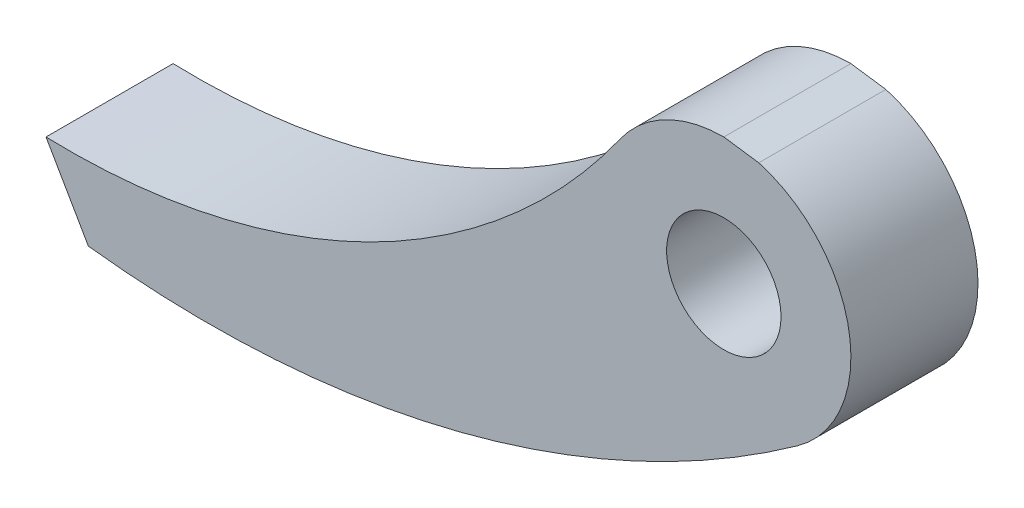
from build123d import *

# Parameters (mm, degrees)
SKETCH1_R  = 1.35
PAWL_DEPTH = 1.5


with BuildPart() as part:
    # Sketch1 → Pawl (new, symmetric)
    with BuildSketch(Plane.XY):
        with BuildLine():
            Line((0.824491602, 2.884478046), (0, 3))
            ThreePointArc((0, 3), (-1.377173166, 2.665219329), (-2.446979028, 1.735596047))
            ThreePointArc((-2.446979028, 1.735596047), (-8.376740645, -3.335986631), (-16, -5))
            Line((-16, -5), (-15, -6.732050808))
            ThreePointArc((-15, -6.732050808), (-6.23012531, -6.146721639), (1.740902704, -2.443206454))
            ThreePointArc((1.740902704, -2.443206454), (2.956580376, 0.508559221), (0.824491602, 2.884478046))
        make_face()
        Circle(SKETCH1_R, mode=Mode.SUBTRACT)
    extrude(amount=PAWL_DEPTH, both=True)


solid = part.part
